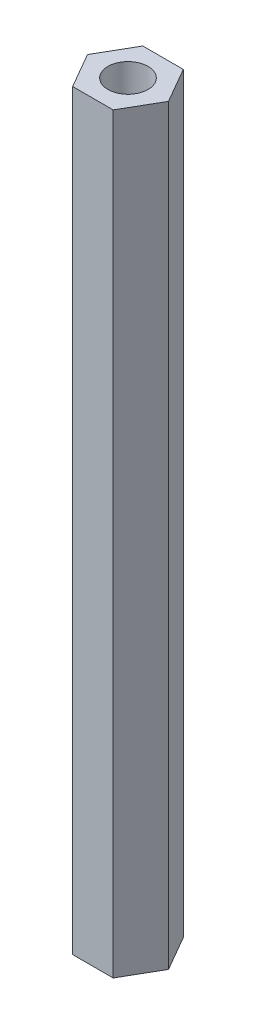
from build123d import *

# Parameters (mm, degrees)
SKETCH1_R           = 2
BOSS_EXTRUDE1_DEPTH = 75


with BuildPart() as part:
    # Sketch1 → Boss-Extrude1 (new body)
    with BuildSketch(Plane(origin=(0, 0, 0), x_dir=(1, 0, 0), z_dir=(0, 1, 0))):
        Polygon((2.020725942, 3.5), (-2.020725942, 3.5), (-4.041451884, 0), (-2.020725942, -3.5), (2.020725942, -3.5), (4.041451884, 0), align=None)
        with Locations(Location((0, 0, 0), (0, 0, 270))):
            Circle(SKETCH1_R, mode=Mode.SUBTRACT)
    extrude(amount=BOSS_EXTRUDE1_DEPTH)


solid = part.part
